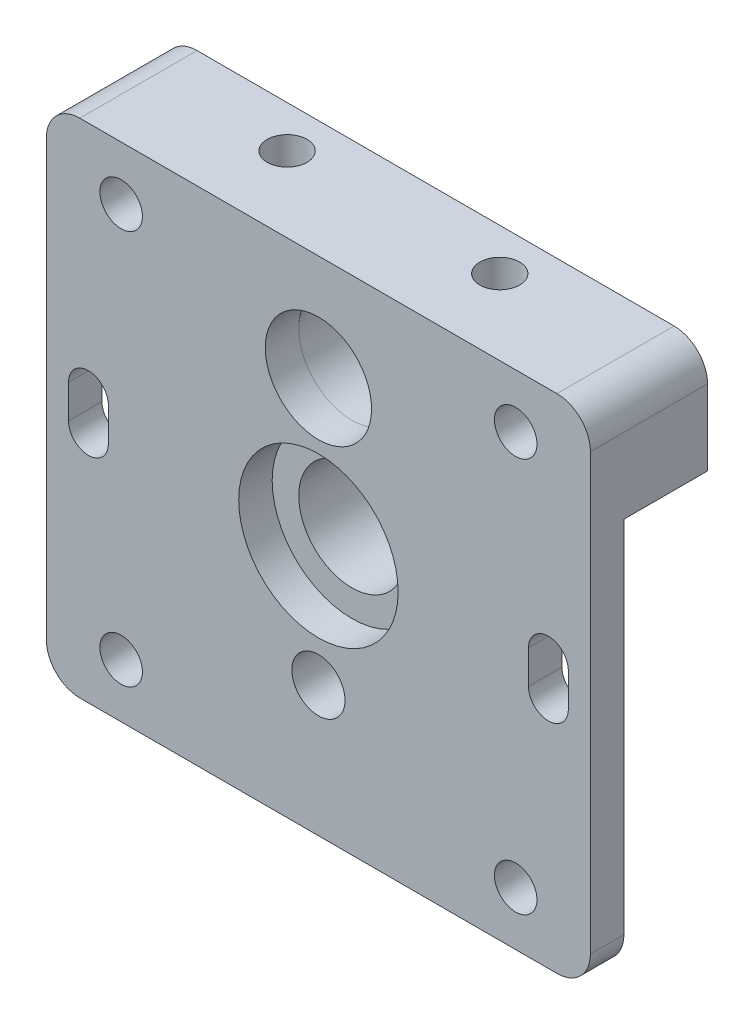
from build123d import *

# Parameters (mm, degrees)
SKETCH3_R             = 6.35
SKETCH3_R_2           = 3.175
SKETCH3_R_3           = 2.54
BOSS_EXTRUDE1_DEPTH   = 10
SKETCH2_R             = 2.54
SKETCH2_R_2           = 9.525
SKETCH2_R_3           = 6.35
SKETCH2_R_4           = 3.175
BOSS_EXTRUDE2_DEPTH   = 4
BODY_MOVE_COPY1_ANGLE = 180
SKETCH6_R             = 2.38125
CUT_EXTRUDE1_DEPTH    = 60
BODY_MOVE_COPY2_ANGLE = 90


with BuildPart() as part:
    # Sketch3 → Boss-Extrude1 (new body)
    with BuildSketch(Plane(origin=(0, 0, 0), x_dir=(0, 0, -1), z_dir=(1, 0, 0))):
        with BuildLine():
            Line((19.772410398, 15.481894129), (11.232662335, -18.916334544))
            ThreePointArc((11.232662335, -18.916334544), (0.02933332, -21.999989892), (-11.182178927, -18.946220999))
            Line((-11.182178927, -18.946220999), (-19.828177454, 15.48706861))
            ThreePointArc((-19.828177454, 15.48706861), (-20.537949261, 16.577044264), (-21.767962021, 17))
            Line((-21.767962021, 17), (-32.5, 17))
            Line((-32.5, 17), (-32.5, 26))
            ThreePointArc((-32.5, 26), (-31.328427125, 28.828427125), (-28.5, 30))
            Line((-28.5, 30), (28.5, 30))
            ThreePointArc((28.5, 30), (31.328427125, 28.828427125), (32.5, 26))
            Line((32.5, 26), (32.5, 17))
            Line((32.5, 17), (21.713486916, 17))
            ThreePointArc((21.713486916, 17), (20.481372526, 16.575402846), (19.772410398, 15.481894129))
        make_face()
        Circle(SKETCH3_R, mode=Mode.SUBTRACT)
        with Locations((0, 17.272)):
            Circle(SKETCH3_R, mode=Mode.SUBTRACT)
        with Locations((0, -14.415625)):
            Circle(SKETCH3_R_2, mode=Mode.SUBTRACT)
        with Locations((-23.5712, 23.5712)):
            Circle(SKETCH3_R_3, mode=Mode.SUBTRACT)
        with Locations((23.5712, 23.5712)):
            Circle(SKETCH3_R_3, mode=Mode.SUBTRACT)
    extrude(amount=BOSS_EXTRUDE1_DEPTH)

    # Sketch2 → Boss-Extrude2 (add)
    with BuildSketch(Plane(origin=(10, 0, 0), x_dir=(0, 0, -1), z_dir=(1, 0, 0))):
        with BuildLine():
            Line((-28.5, 30), (28.5, 30))
            ThreePointArc((28.5, 30), (31.328427125, 28.828427125), (32.5, 26))
            Line((32.5, 26), (32.5, -26))
            ThreePointArc((32.5, -26), (31.328427125, -28.828427125), (28.5, -30))
            Line((28.5, -30), (-28.5, -30))
            ThreePointArc((-28.5, -30), (-31.328427125, -28.828427125), (-32.5, -26))
            Line((-32.5, -26), (-32.5, 26))
            ThreePointArc((-32.5, 26), (-31.328427125, 28.828427125), (-28.5, 30))
        make_face()
        with Locations((23.5712, 23.5712)):
            Circle(SKETCH2_R, mode=Mode.SUBTRACT)
        with Locations((-23.5712, 23.5712)):
            Circle(SKETCH2_R, mode=Mode.SUBTRACT)
        with Locations((-23.5712, -23.5712)):
            Circle(SKETCH2_R, mode=Mode.SUBTRACT)
        with Locations((23.5712, -23.5712)):
            Circle(SKETCH2_R, mode=Mode.SUBTRACT)
        Circle(SKETCH2_R_2, mode=Mode.SUBTRACT)
        with Locations(Location((0, 17.3355, 0), (0, 0, 180.286480091))):
            Circle(SKETCH2_R_3, mode=Mode.SUBTRACT)
        with Locations((0, -14.415625)):
            Circle(SKETCH2_R_4, mode=Mode.SUBTRACT)
        with BuildLine():
            Line((-29.8625, -2), (-29.8625, 2))
            ThreePointArc((-29.8625, 2), (-27.48125, 4.38125), (-25.1, 2))
            Line((-25.1, 2), (-25.1, -2))
            ThreePointArc((-25.1, -2), (-27.48125, -4.38125), (-29.8625, -2))
        make_face(mode=Mode.SUBTRACT)
        with BuildLine():
            Line((25.1, -2), (25.1, 2))
            ThreePointArc((25.1, 2), (27.48125, 4.38125), (29.8625, 2))
            Line((29.8625, 2), (29.8625, -2))
            ThreePointArc((29.8625, -2), (27.48125, -4.38125), (25.1, -2))
        make_face(mode=Mode.SUBTRACT)
    extrude(amount=BOSS_EXTRUDE2_DEPTH)


with BuildPart() as part_1:
    # Body-Move/Copy1: moved
    add(part.part.rotate(Axis((7, 0, 0.02), (0, 1, 0)), BODY_MOVE_COPY1_ANGLE))

    # Sketch6 → Cut-Extrude1 (cut)
    with BuildSketch(Plane(origin=(0, 30, 0), x_dir=(-1, 0, 0), z_dir=(0, 1, 0))):
        with Locations(Location((-8.999786825, -12.69999899, 0), (0, 0, 90))):
            Circle(SKETCH6_R)
        with Locations(Location((-9.00991527, 12.69999899, 0), (0, 0, 90))):
            Circle(SKETCH6_R)
    extrude(amount=-CUT_EXTRUDE1_DEPTH, mode=Mode.SUBTRACT)


with BuildPart() as part_2:
    # Body-Move/Copy2: moved
    add(part_1.part.rotate(Axis((7.0000125, 0, 0.04), (0, 1, 0)), BODY_MOVE_COPY2_ANGLE))


solid = part_2.part
